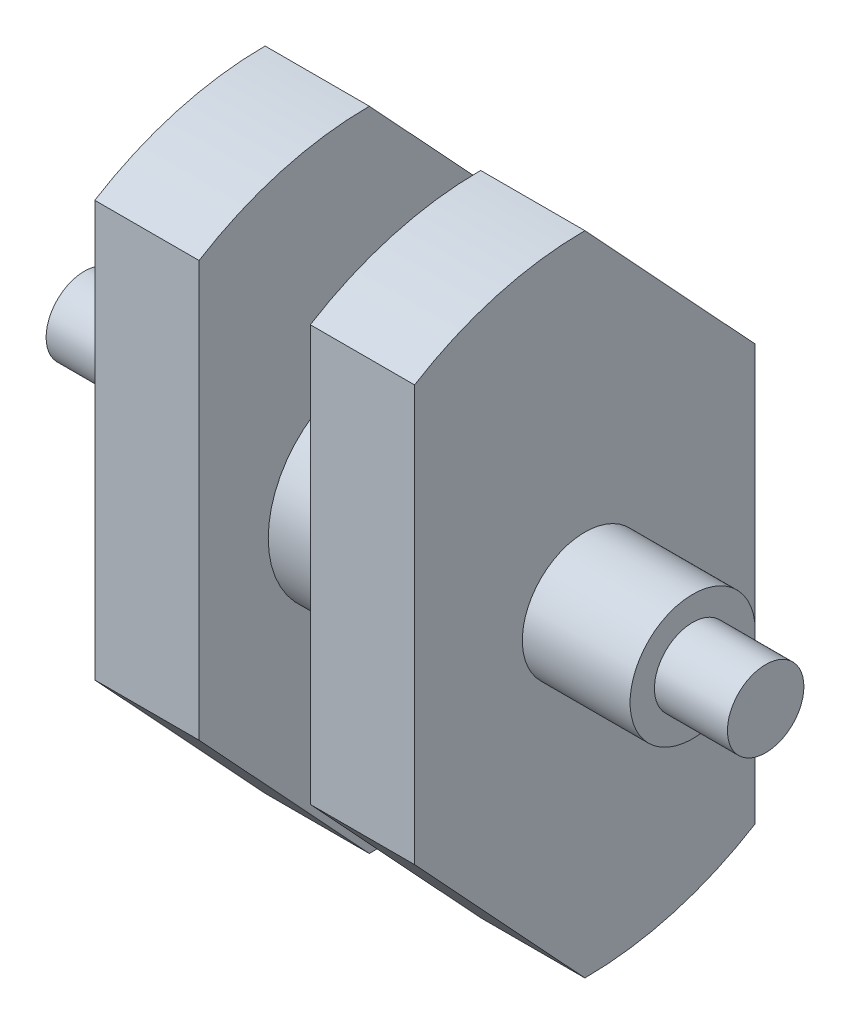
from build123d import *

# Parameters (mm, degrees)
ESBO_O1_R                  = 46.55
RESSALTO_EXTRUS_O1_DEPTH   = 49
CORTE_EXTRUS_O2_DEPTH      = 83.0658577
CORTE_EXTRUS_O2_DEPTH_BACK = 83.0658577
CORTE_EXTRUS_O10_START     = -49
ESBO_O3_OUTSIDE_W          = 79.756
ESBO_O3_OUTSIDE_H          = 123.856
ESBO_O3_OUTSIDE_R          = 9
CORTE_EXTRUS_O10_DEPTH     = 26
CORTE_EXTRUS_O11_START     = 49
ESBO_O6_OUTSIDE_W          = 79.756
ESBO_O6_OUTSIDE_H          = 123.856
ESBO_O6_OUTSIDE_R          = 9
CORTE_EXTRUS_O11_DEPTH     = 26
ESBO_O7_OUTSIDE_W          = 79.756
ESBO_O7_OUTSIDE_H          = 123.856
ESBO_O7_OUTSIDE_R          = 5.5
CORTE_EXTRUS_O12_DEPTH     = 10.5
ESBO_O8_OUTSIDE_W          = 79.756
ESBO_O8_OUTSIDE_H          = 123.856
ESBO_O8_OUTSIDE_R          = 5.5
CORTE_EXTRUS_O13_DEPTH     = 10.5
ESBO_O9_W                  = 16
ESBO_O9_H                  = 36.861601527


with BuildPart() as part:
    # Esboço1 → Ressalto-extrusão1 (new, symmetric)
    with BuildSketch(Plane(origin=(0, 0, 0), x_dir=(0, 0, -1), z_dir=(1, 0, 0))):
        Circle(ESBO_O1_R)
    extrude(amount=RESSALTO_EXTRUS_O1_DEPTH, both=True)

    # Esboço2 → Corte-extrusão2 (cut, two sides: drawn at the far end of the back side and taken through both)
    with BuildSketch(Plane(origin=(0, 0, 0), x_dir=(0, 0, -1), z_dir=(1, 0, 0)).offset(-CORTE_EXTRUS_O2_DEPTH_BACK)):
        with BuildLine():
            Line((-24.5, -20.172926622), (-24.5, 39.580961332))
            ThreePointArc((-24.5, 39.580961332), (-46.55, 0), (-24.5, -39.580961332))
            Line((-24.5, -39.580961332), (-24.5, -20.172926622))
        make_face()
        with BuildLine():
            ThreePointArc((-24.5, -39.580961332), (-12.735948139, -44.773855374), (0, -46.55))
            Line((0, -46.55), (-24.5, -20.172926622))
            Line((-24.5, -20.172926622), (-24.5, -39.580961332))
        make_face()
        with BuildLine():
            ThreePointArc((46.55, 0), (40.665572048, 22.654221461), (24.5, 39.580961332))
            Line((24.5, 39.580961332), (24.5, 20.172926622))
            Line((24.5, 20.172926622), (24.5, -39.580961332))
            ThreePointArc((24.5, -39.580961332), (40.665572048, -22.654221461), (46.55, 0))
        make_face()
        with BuildLine():
            Line((24.5, 20.172926622), (24.5, 39.580961332))
            ThreePointArc((24.5, 39.580961332), (12.735948139, 44.773855374), (0, 46.55))
            Line((0, 46.55), (24.5, 20.172926622))
        make_face()
    extrude(amount=CORTE_EXTRUS_O2_DEPTH + CORTE_EXTRUS_O2_DEPTH_BACK, mode=Mode.SUBTRACT)

    # Esboço3 outside → Corte-extrusão10 (cut)
    with BuildSketch(Plane(origin=(0, 0, 0), x_dir=(0, 0, -1), z_dir=(1, 0, 0)).offset(CORTE_EXTRUS_O10_START)):
        Rectangle(ESBO_O3_OUTSIDE_W, ESBO_O3_OUTSIDE_H)
        with Locations(Location((0, 0, 0), (0, 0, 180))):
            Circle(ESBO_O3_OUTSIDE_R, mode=Mode.SUBTRACT)
    extrude(amount=CORTE_EXTRUS_O10_DEPTH, mode=Mode.SUBTRACT)

    # Esboço6 outside → Corte-extrusão11 (cut)
    with BuildSketch(Plane(origin=(0, 0, 0), x_dir=(0, 0, -1), z_dir=(1, 0, 0)).offset(CORTE_EXTRUS_O11_START)):
        Rectangle(ESBO_O6_OUTSIDE_W, ESBO_O6_OUTSIDE_H)
        with Locations(Location((0, 0, 0), (0, 0, 180))):
            Circle(ESBO_O6_OUTSIDE_R, mode=Mode.SUBTRACT)
    extrude(amount=-CORTE_EXTRUS_O11_DEPTH, mode=Mode.SUBTRACT)

    # Esboço7 outside → Corte-extrusão12 (cut)
    with BuildSketch(Plane(origin=(49, 0, 0), x_dir=(0, 0, -1), z_dir=(1, 0, 0))):
        Rectangle(ESBO_O7_OUTSIDE_W, ESBO_O7_OUTSIDE_H)
        Circle(ESBO_O7_OUTSIDE_R, mode=Mode.SUBTRACT)
    extrude(amount=-CORTE_EXTRUS_O12_DEPTH, mode=Mode.SUBTRACT)

    # Esboço8 outside → Corte-extrusão13 (cut)
    with BuildSketch(Plane.ZY.offset(49)):
        Rectangle(ESBO_O8_OUTSIDE_W, ESBO_O8_OUTSIDE_H)
        with Locations(Location((0, 0, 0), (0, 0, 180))):
            Circle(ESBO_O8_OUTSIDE_R, mode=Mode.SUBTRACT)
    extrude(amount=-CORTE_EXTRUS_O13_DEPTH, mode=Mode.SUBTRACT)

    # Esboço9 → Corte-Revolução1 (revolve, cut)
    with BuildSketch(Plane.XY, mode=Mode.PRIVATE) as corte_revolu_o1_sk:
        with Locations((0, 32.980800763)):
            Rectangle(ESBO_O9_W, ESBO_O9_H)
    revolve(corte_revolu_o1_sk.sketch.rotate(Axis((-1000, 0, 0), (1, 0, 0)), 90), axis=Axis((-1000, 0, 0), (1, 0, 0)), mode=Mode.SUBTRACT)


solid = part.part
